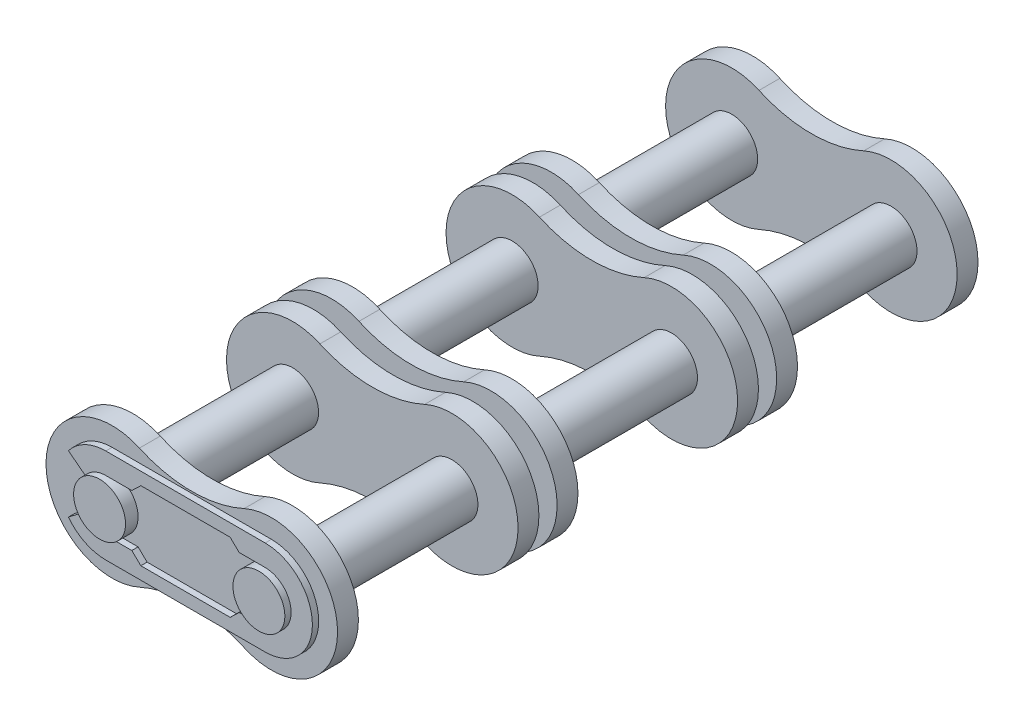
from build123d import *

# Parameters (mm, degrees)
AUFSATZ_LINEAR_AUSTRAGEN1_DEPTH  = 18.05
SKIZZE3_R                        = 4.14
SCHNITT_LINEAR_AUSTRAGEN1_DEPTH  = 12.725
SKIZZE4_R                        = 4.14
SCHNITT_LINEAR_AUSTRAGEN2_DEPTH  = 2
AUFSATZ_LINEAR_AUSTRAGEN2_DEPTH  = 1
LINEARES_MUSTER6_COUNT           = 3
LINEARES_MUSTER6_PITCH           = 35
LINEARES_MUSTER6_COPY_1_SKETCH_R = 4.14
LINEARES_MUSTER6_COPY_1_DEPTH    = 2
LINEARES_MUSTER6_COPY_2_SKETCH_R = 4.14
LINEARES_MUSTER6_COPY_2_DEPTH    = 2


with BuildPart() as part:
    # Skizze1 → Aufsatz-Linear austragen1 (new, symmetric)
    with BuildSketch(Plane.XY):
        with BuildLine():
            ThreePointArc((-8.350956521, 9.600907291), (-23.24, 0), (-8.350956521, -9.600907291))
            ThreePointArc((-8.350956521, -9.600907291), (0, -7.797678049), (8.350956521, -9.600907291))
            ThreePointArc((8.350956521, -9.600907291), (23.24, 0), (8.350956521, 9.600907291))
            ThreePointArc((8.350956521, 9.600907291), (0, 7.797678049), (-8.350956521, 9.600907291))
        make_face()
    aufsatz_linear_austragen1 = extrude(amount=AUFSATZ_LINEAR_AUSTRAGEN1_DEPTH, both=True)

    # Skizze3 → Schnitt-Linear austragen1 (cut, symmetric)
    with BuildSketch(Plane.XY):
        with BuildLine():
            ThreePointArc((-8.350956521, 9.600907291), (-23.24, 0), (-8.350956521, -9.600907291))
            ThreePointArc((-8.350956521, -9.600907291), (0, -7.797678049), (8.350956521, -9.600907291))
            ThreePointArc((8.350956521, -9.600907291), (23.24, 0), (8.350956521, 9.600907291))
            ThreePointArc((8.350956521, 9.600907291), (0, 7.797678049), (-8.350956521, 9.600907291))
        make_face()
        with Locations((-12.7, 0)):
            Circle(SKIZZE3_R, mode=Mode.SUBTRACT)
        with Locations((12.7, 0)):
            Circle(SKIZZE3_R, mode=Mode.SUBTRACT)
    schnitt_linear_austragen1 = extrude(amount=SCHNITT_LINEAR_AUSTRAGEN1_DEPTH, both=True, mode=Mode.SUBTRACT)

    # Skizze4 → Schnitt-Linear austragen2 (cut)
    with BuildSketch(Plane.XY.offset(18.05)):
        with BuildLine():
            ThreePointArc((-8.350956521, 9.600907291), (-23.24, 0), (-8.350956521, -9.600907291))
            ThreePointArc((-8.350956521, -9.600907291), (0, -7.797678049), (8.350956521, -9.600907291))
            ThreePointArc((8.350956521, -9.600907291), (23.24, 0), (8.350956521, 9.600907291))
            ThreePointArc((8.350956521, 9.600907291), (0, 7.797678049), (-8.350956521, 9.600907291))
        make_face()
        with Locations((-12.7, 0)):
            Circle(SKIZZE4_R, mode=Mode.SUBTRACT)
        with Locations((12.7, 0)):
            Circle(SKIZZE4_R, mode=Mode.SUBTRACT)
    schnitt_linear_austragen2 = extrude(amount=-SCHNITT_LINEAR_AUSTRAGEN2_DEPTH, mode=Mode.SUBTRACT)

    # Spiegeln1: Schnitt-Linear austragen2 across plane
    add(schnitt_linear_austragen2.mirror(Plane.XY), mode=Mode.SUBTRACT)

    # Skizze5 → Aufsatz-Linear austragen2 (add)
    with BuildSketch(Plane.XY.offset(16.05)):
        with BuildLine():
            Line((-18.67281729, 4.583103901), (-15.984482829, 2.520272316))
            ThreePointArc((-15.984482829, 2.520272316), (-14.531075178, 3.71305315), (-12.7, 4.14))
            Line((-12.7, 4.14), (-8.56, 4.14))
            Line((-8.56, 4.14), (-7.120601032, 5.528571429))
            Line((-7.120601032, 5.528571429), (7.120601032, 5.528571429))
            Line((7.120601032, 5.528571429), (8.56, 4.14))
            Line((8.56, 4.14), (12.7, 4.14))
            ThreePointArc((12.7, 4.14), (16.84, 0), (12.7, -4.14))
            Line((12.7, -4.14), (8.56, -4.14))
            Line((8.56, -4.14), (7.120601032, -5.528571429))
            Line((7.120601032, -5.528571429), (-7.120601032, -5.528571429))
            Line((-7.120601032, -5.528571429), (-8.56, -4.14))
            Line((-8.56, -4.14), (-12.7, -4.14))
            ThreePointArc((-12.7, -4.14), (-14.531075178, -3.71305315), (-15.984482829, -2.520272316))
            Line((-15.984482829, -2.520272316), (-18.67281729, -4.583103901))
            ThreePointArc((-18.67281729, -4.583103901), (-16.029801996, -6.752170497), (-12.7, -7.528571429))
            Line((-12.7, -7.528571429), (12.7, -7.528571429))
            ThreePointArc((12.7, -7.528571429), (20.228571429, 0), (12.7, 7.528571429))
            Line((12.7, 7.528571429), (-12.7, 7.528571429))
            ThreePointArc((-12.7, 7.528571429), (-16.029801996, 6.752170497), (-18.67281729, 4.583103901))
        make_face()
    extrude(amount=AUFSATZ_LINEAR_AUSTRAGEN2_DEPTH)

    # Lineares Muster6: Aufsatz-Linear austragen1, Schnitt-Linear austragen1, Schnitt-Linear austragen2 ×3
    with Locations(*[(0, 0, -i * LINEARES_MUSTER6_PITCH) for i in range(1, LINEARES_MUSTER6_COUNT)]):
        add(aufsatz_linear_austragen1)
        add(schnitt_linear_austragen1, mode=Mode.SUBTRACT)
        add(schnitt_linear_austragen2, mode=Mode.SUBTRACT)

    # Lineares Muster6 copy 1 sketch → Lineares Muster6 copy 1 (cut)
    with BuildSketch(Plane(origin=(0, 0, -53.05), x_dir=(1, 0, 0), z_dir=(0, 0, -1))):
        with BuildLine():
            ThreePointArc((-8.350956521, -9.600907291), (-23.24, 0), (-8.350956521, 9.600907291))
            ThreePointArc((-8.350956521, 9.600907291), (0, 7.797678049), (8.350956521, 9.600907291))
            ThreePointArc((8.350956521, 9.600907291), (23.24, 0), (8.350956521, -9.600907291))
            ThreePointArc((8.350956521, -9.600907291), (0, -7.797678049), (-8.350956521, -9.600907291))
        make_face()
        with Locations((-12.7, 0)):
            Circle(LINEARES_MUSTER6_COPY_1_SKETCH_R, mode=Mode.SUBTRACT)
        with Locations((12.7, 0)):
            Circle(LINEARES_MUSTER6_COPY_1_SKETCH_R, mode=Mode.SUBTRACT)
    extrude(amount=-LINEARES_MUSTER6_COPY_1_DEPTH, mode=Mode.SUBTRACT)

    # Lineares Muster6 copy 2 sketch → Lineares Muster6 copy 2 (cut)
    with BuildSketch(Plane(origin=(0, 0, -88.05), x_dir=(1, 0, 0), z_dir=(0, 0, -1))):
        with BuildLine():
            ThreePointArc((-8.350956521, -9.600907291), (-23.24, 0), (-8.350956521, 9.600907291))
            ThreePointArc((-8.350956521, 9.600907291), (0, 7.797678049), (8.350956521, 9.600907291))
            ThreePointArc((8.350956521, 9.600907291), (23.24, 0), (8.350956521, -9.600907291))
            ThreePointArc((8.350956521, -9.600907291), (0, -7.797678049), (-8.350956521, -9.600907291))
        make_face()
        with Locations((-12.7, 0)):
            Circle(LINEARES_MUSTER6_COPY_2_SKETCH_R, mode=Mode.SUBTRACT)
        with Locations((12.7, 0)):
            Circle(LINEARES_MUSTER6_COPY_2_SKETCH_R, mode=Mode.SUBTRACT)
    extrude(amount=-LINEARES_MUSTER6_COPY_2_DEPTH, mode=Mode.SUBTRACT)


solid = part.part
